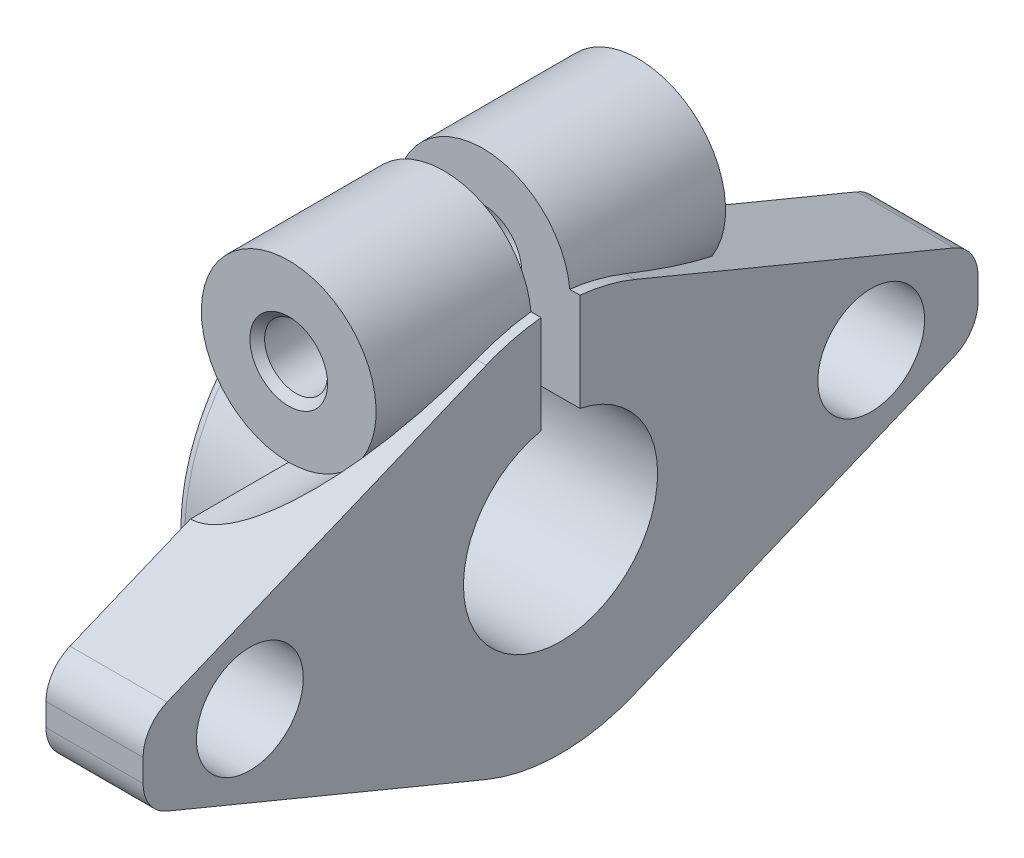
from build123d import *

# Parameters (mm, degrees)
EXTRUDE_1_DEPTH      = 5
EXTRUDE_2_DEPTH      = 9
EXTRUDE_2_DEPTH_BACK = 9
SKETCH_3_R           = 4.5
CUT_EXTRUDE_1_DEPTH  = 9
SKETCH_5_W           = 2
SKETCH_5_H           = 24
CUT_EXTRUDE_2_DEPTH  = 10
SKETCH_9_R           = 2.75
CUT_EXTRUDE_3_DEPTH  = 5
SKETCH_10_R          = 2.75
CUT_EXTRUDE_4_DEPTH  = 5


with BuildPart() as part:
    # 草圖1 → 填料-伸長1 (new body)
    with BuildSketch(Plane(origin=(0, 0, 0), x_dir=(0, 0, -1), z_dir=(1, 0, 0))):
        with BuildLine():
            Line((-21.5, 0.581973136), (-21.5, -0.581973136))
            ThreePointArc((-21.5, -0.581973136), (-21.162939225, -1.693113602), (-20.265366865, -2.429732201))
            Line((-20.265366865, -2.429732201), (-3.826834324, -9.238795325))
            ThreePointArc((-3.826834324, -9.238795325), (-1.95090322, -9.807852804), (0, -10))
            ThreePointArc((0, -10), (1.95090322, -9.807852804), (3.826834324, -9.238795325))
            Line((3.826834324, -9.238795325), (20.265366865, -2.429732201))
            ThreePointArc((20.265366865, -2.429732201), (21.162939225, -1.693113602), (21.5, -0.581973136))
            Line((21.5, -0.581973136), (21.5, 0.581973136))
            ThreePointArc((21.5, 0.581973136), (21.162939225, 1.693113602), (20.265366865, 2.429732201))
            Line((20.265366865, 2.429732201), (3.826834324, 9.238795325))
            ThreePointArc((3.826834324, 9.238795325), (1.95090322, 9.807852804), (0, 10))
            ThreePointArc((0, 10), (-1.95090322, 9.807852804), (-3.826834324, 9.238795325))
            Line((-3.826834324, 9.238795325), (-20.265366865, 2.429732201))
            ThreePointArc((-20.265366865, 2.429732201), (-21.162939225, 1.693113602), (-21.5, 0.581973136))
        make_face()
    extrude(amount=-EXTRUDE_1_DEPTH)

    # 草圖2 → 旋轉1 (revolve)
    with BuildSketch(Plane.XY, mode=Mode.PRIVATE) as revolve_1_sk:
        with BuildLine():
            Line((-10, 0), (-10, 9.334826255))
            ThreePointArc((-10, 9.334826255), (-9.857424619, 9.687712707), (-9.509728944, 9.842516795))
            Line((-9.509728944, 9.842516795), (-5, 10))
            Line((-5, 10), (-5, 0))
            Line((-5, 0), (-10, 0))
        make_face()
    revolve(revolve_1_sk.sketch.rotate(Axis((-5, 0, 0), (-1, 0, 0)), 270), axis=Axis((-5, 0, 0), (-1, 0, 0)))

    # 草圖3 → 填料-伸長2 (add, two sides: drawn at the far end of the back side and taken through both)
    with BuildSketch(Plane.XY.offset(-EXTRUDE_2_DEPTH_BACK)):
        with Locations((-5, 9.5)):
            Circle(SKETCH_3_R)
    extrude(amount=EXTRUDE_2_DEPTH + EXTRUDE_2_DEPTH_BACK)

    # 草圖4 → 除料-伸長1 (cut)
    with BuildSketch(Plane.XY.offset(9)):
        with BuildLine():
            Line((-10, 5), (-5, 5))
            ThreePointArc((-5, 5), (-1.818019485, 12.681980515), (-9.5, 9.5))
            Line((-9.5, 9.5), (-10, 9.5))
            Line((-10, 9.5), (-10, 5))
        make_face()
    extrude(amount=CUT_EXTRUDE_1_DEPTH, mode=Mode.SUBTRACT)

    # 草圖5 → 除料-伸長2 (cut)
    with BuildSketch(Plane(origin=(0, 0, 0), x_dir=(0, 0, -1), z_dir=(1, 0, 0))):
        with Locations((0, 12)):
            Rectangle(SKETCH_5_W, SKETCH_5_H)
    extrude(amount=-CUT_EXTRUDE_2_DEPTH, mode=Mode.SUBTRACT)

    # 草圖6 → 除料-旋轉1 (revolve, cut)
    with BuildSketch(Plane.XY):
        Polygon((-10, 0), (-10, 6), (-8.5, 6), (-8.5, 5), (0, 5), (0, 0), align=None)
    revolve(axis=Axis((0, 0, 0), (-1, 0, 0)), mode=Mode.SUBTRACT)

    # 草圖7 → 除料-旋轉2 (revolve, cut)
    with BuildSketch(Plane(origin=(-5, 0, 0), x_dir=(0, 0, -1), z_dir=(1, 0, 0)), mode=Mode.PRIVATE) as cut_revolve_2_sk:
        Polygon((1, 9.5), (1, 11.5), (1.379, 11.121), (8.621, 11.121), (9.1, 11.6), (13.5, 11.6), (13.5, 9.5), align=None)
    revolve(cut_revolve_2_sk.sketch.rotate(Axis((-5, 9.5, -13.5), (0, 0, 1)), 270), axis=Axis((-5, 9.5, -13.5), (0, 0, 1)), mode=Mode.SUBTRACT)

    # 草圖8 → 除料-旋轉3 (revolve, cut)
    with BuildSketch(Plane(origin=(-5, 0, 0), x_dir=(0, 0, -1), z_dir=(1, 0, 0)), mode=Mode.PRIVATE) as cut_revolve_3_sk:
        Polygon((-9, 9.5), (-9, 11.5), (-8.621, 11.121), (-1.379, 11.121), (-1, 11.5), (-1, 9.5), align=None)
    revolve(cut_revolve_3_sk.sketch.rotate(Axis((-5, 9.5, 1), (0, 0, 1)), 270), axis=Axis((-5, 9.5, 1), (0, 0, 1)), mode=Mode.SUBTRACT)

    # 草圖9 → 除料-伸長3 (cut)
    with BuildSketch(Plane(origin=(0, 0, 0), x_dir=(0, 0, -1), z_dir=(1, 0, 0))):
        with Locations((16, 0)):
            Circle(SKETCH_9_R)
    extrude(amount=-CUT_EXTRUDE_3_DEPTH, mode=Mode.SUBTRACT)

    # 草圖10 → 除料-伸長4 (cut)
    with BuildSketch(Plane(origin=(0, 0, 0), x_dir=(0, 0, -1), z_dir=(1, 0, 0))):
        with Locations((-16, 0)):
            Circle(SKETCH_10_R)
    extrude(amount=-CUT_EXTRUDE_4_DEPTH, mode=Mode.SUBTRACT)


solid = part.part
